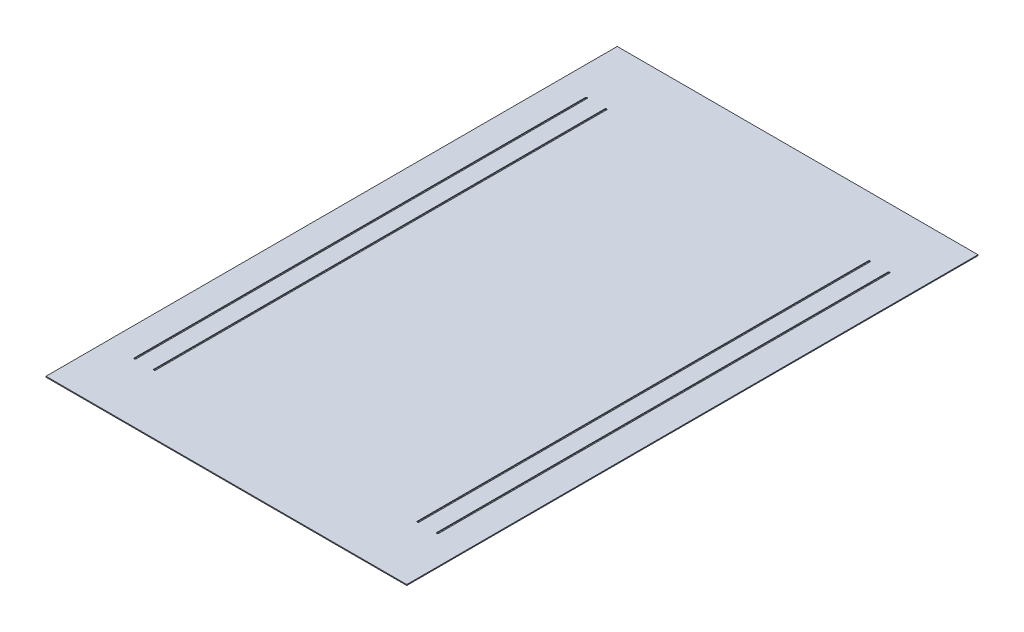
from build123d import *

# Parameters (mm, degrees)
SKETCH1_W           = 1200
SKETCH1_H           = 1900
BOSS_EXTRUDE1_DEPTH = 3


with BuildPart() as part:
    # Sketch1 → Boss-Extrude1 (new body)
    with BuildSketch(Plane(origin=(0, 0, 0), x_dir=(1, 0, 0), z_dir=(0, 1, 0))):
        Rectangle(SKETCH1_W, SKETCH1_H)
        with BuildLine():
            Line((-500, 750), (-500, -750))
            ThreePointArc((-500, -750), (-503, -753), (-506, -750))
            Line((-506, -750), (-506, 750))
            ThreePointArc((-506, 750), (-503, 753), (-500, 750))
        make_face(mode=Mode.SUBTRACT)
        with BuildLine():
            Line((-435, 750), (-435, -750))
            ThreePointArc((-435, -750), (-438, -753), (-441, -750))
            Line((-441, -750), (-441, 750))
            ThreePointArc((-441, 750), (-438, 753), (-435, 750))
        make_face(mode=Mode.SUBTRACT)
        with BuildLine():
            Line((435, 750), (435, -750))
            ThreePointArc((435, -750), (438, -753), (441, -750))
            Line((441, -750), (441, 750))
            ThreePointArc((441, 750), (438, 753), (435, 750))
        make_face(mode=Mode.SUBTRACT)
        with BuildLine():
            Line((500, 750), (500, -750))
            ThreePointArc((500, -750), (503, -753), (506, -750))
            Line((506, -750), (506, 750))
            ThreePointArc((506, 750), (503, 753), (500, 750))
        make_face(mode=Mode.SUBTRACT)
    extrude(amount=BOSS_EXTRUDE1_DEPTH)


solid = part.part
